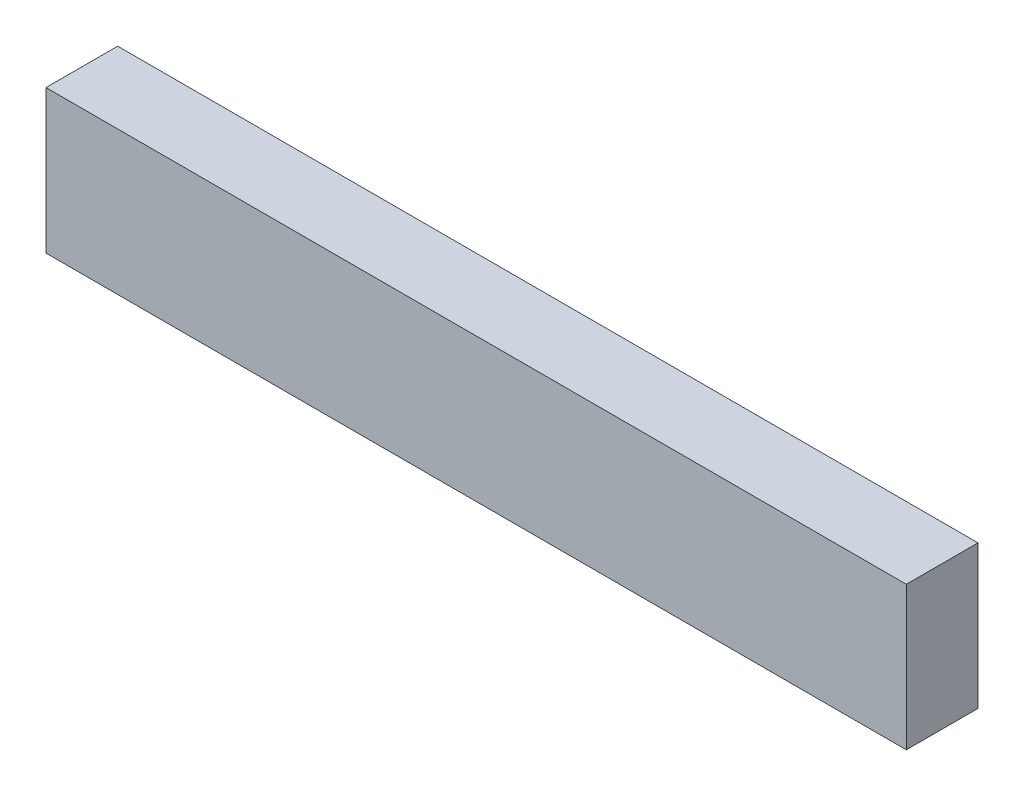
from build123d import *

# Parameters (mm, degrees)
CROQUIS1_W              = 304.8
CROQUIS1_H              = 25.4
SALIENTE_EXTRUIR1_DEPTH = 50.8


with BuildPart() as part:
    # Croquis1 → Saliente-Extruir1 (new body)
    with BuildSketch(Plane(origin=(0, 0, 0), x_dir=(1, 0, 0), z_dir=(0, 1, 0))):
        Rectangle(CROQUIS1_W, CROQUIS1_H)
    extrude(amount=SALIENTE_EXTRUIR1_DEPTH)


solid = part.part
